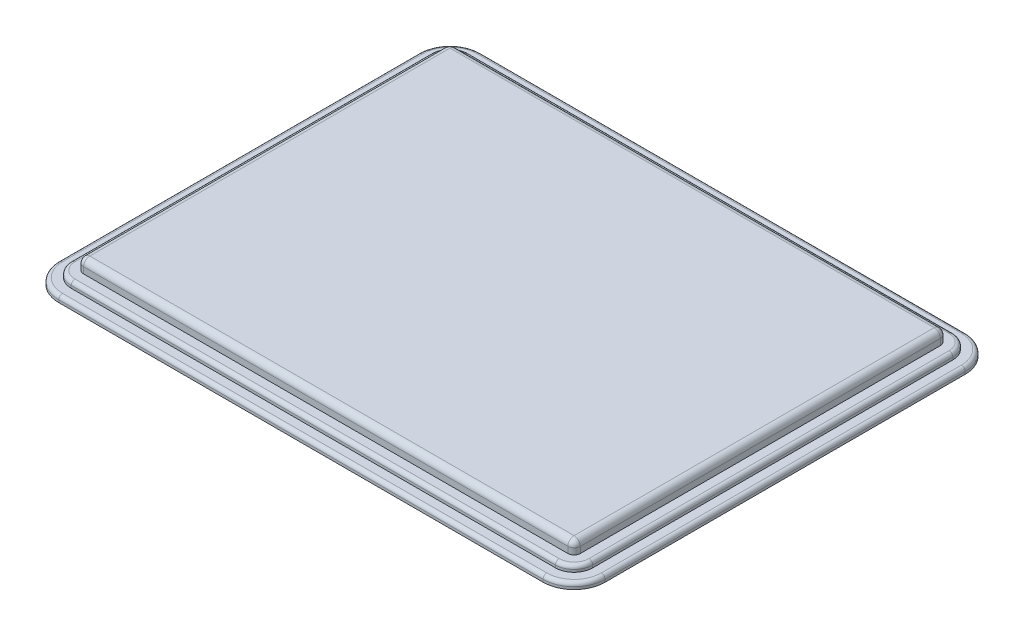
from build123d import *

# Parameters (mm, degrees)
BOSS_EXTRUDE1_DEPTH = 10
FILLET1_R           = 5
BOSS_EXTRUDE2_DEPTH = 5
BOSS_EXTRUDE3_DEPTH = 5
FILLET2_R           = 3
FILLET3_R           = 3


with BuildPart() as part:
    # Sketch3 → Boss-Extrude1 (new body)
    with BuildSketch(Plane(origin=(0, 0, 0), x_dir=(1, 0, 0), z_dir=(0, 1, 0))):
        with BuildLine():
            Line((195, -150), (-195, -150))
            ThreePointArc((-195, -150), (-198.535533906, -148.535533906), (-200, -145))
            Line((-200, -145), (-200, 145))
            ThreePointArc((-200, 145), (-198.535533906, 148.535533906), (-195, 150))
            Line((-195, 150), (195, 150))
            ThreePointArc((195, 150), (198.535533906, 148.535533906), (200, 145))
            Line((200, 145), (200, -145))
            ThreePointArc((200, -145), (198.535533906, -148.535533906), (195, -150))
        make_face()
    extrude(amount=BOSS_EXTRUDE1_DEPTH)

    # Fillet1
    fillet1_edges = [part.edges().sort_by_distance(p)[0] for p in [
        (198.535533906, 10, 148.535533906),
        (200, 10, 0),
        (198.535533906, 10, -148.535533906),
        (0, 10, -150),
        (-198.535533906, 10, -148.535533906),
        (-200, 10, 0),
        (-198.535533906, 10, 148.535533906),
        (0, 10, 150),
    ]]
    fillet(fillet1_edges, radius=FILLET1_R)


with BuildPart() as body_2:
    # Sketch4 → Boss-Extrude2 (new body)
    # profile 1 of 3: a face of its own
    with BuildSketch(Plane.XZ):
        with BuildLine():
            Line((195, 160), (-195, 160))
            ThreePointArc((-195, 160), (-205.606601718, 155.606601718), (-210, 145))
            Line((-210, 145), (-210, -145))
            ThreePointArc((-210, -145), (-205.606601718, -155.606601718), (-195, -160))
            Line((-195, -160), (195, -160))
            ThreePointArc((195, -160), (205.606601718, -155.606601718), (210, -145))
            Line((210, -145), (210, 145))
            ThreePointArc((210, 145), (205.606601718, 155.606601718), (195, 160))
        make_face()
        with BuildLine():
            ThreePointArc((-195, 150), (-198.535533906, 148.535533906), (-200, 145))
            Line((-200, 145), (-200, -145))
            ThreePointArc((-200, -145), (-198.535533906, -148.535533906), (-195, -150))
            Line((-195, -150), (195, -150))
            ThreePointArc((195, -150), (198.535533906, -148.535533906), (200, -145))
            Line((200, -145), (200, 145))
            ThreePointArc((200, 145), (198.535533906, 148.535533906), (195, 150))
            Line((195, 150), (-195, 150))
        make_face(mode=Mode.SUBTRACT)
    # profile 2 of 3: a face of its own
    with BuildSketch(Plane.XZ):
        with BuildLine():
            Line((195, 150), (-195, 150))
            ThreePointArc((-195, 150), (-198.535533906, 148.535533906), (-200, 145))
            Line((-200, 145), (-200, -145))
            ThreePointArc((-200, -145), (-198.535533906, -148.535533906), (-195, -150))
            Line((-195, -150), (195, -150))
            ThreePointArc((195, -150), (198.535533906, -148.535533906), (200, -145))
            Line((200, -145), (200, 145))
            ThreePointArc((200, 145), (198.535533906, 148.535533906), (195, 150))
        make_face()
    # profile 3 of 3: a face of its own
    with BuildSketch(Plane.XZ):
        with BuildLine():
            ThreePointArc((-195, 150), (-198.535533906, 148.535533906), (-200, 145))
            Line((-200, 145), (-200, -145))
            ThreePointArc((-200, -145), (-198.535533906, -148.535533906), (-195, -150))
            Line((-195, -150), (195, -150))
            ThreePointArc((195, -150), (198.535533906, -148.535533906), (200, -145))
            Line((200, -145), (200, 145))
            ThreePointArc((200, 145), (198.535533906, 148.535533906), (195, 150))
            Line((195, 150), (-195, 150))
        make_face()
    extrude(amount=BOSS_EXTRUDE2_DEPTH)

    # Fillet2
    fillet2_edges = [body_2.edges().sort_by_distance(p)[0] for p in [
        (210, 0, 0),
        (205.606601718, 0, -155.606601718),
        (0, 0, -160),
        (-205.606601718, 0, -155.606601718),
        (-210, 0, 0),
        (-205.606601718, 0, 155.606601718),
        (0, 0, 160),
        (205.606601718, 0, 155.606601718),
    ]]
    fillet(fillet2_edges, radius=FILLET2_R)


with BuildPart() as body_3:
    # Sketch5 → Boss-Extrude3 (new body)
    # profile 1 of 3: a face of its own
    with BuildSketch(Plane.XZ.offset(5)):
        with BuildLine():
            Line((195, 170), (-195, 170))
            ThreePointArc((-195, 170), (-212.67766953, 162.67766953), (-220, 145))
            Line((-220, 145), (-220, -145))
            ThreePointArc((-220, -145), (-212.67766953, -162.67766953), (-195, -170))
            Line((-195, -170), (195, -170))
            ThreePointArc((195, -170), (212.67766953, -162.67766953), (220, -145))
            Line((220, -145), (220, 145))
            ThreePointArc((220, 145), (212.67766953, 162.67766953), (195, 170))
        make_face()
        with BuildLine():
            Line((195, 160), (-195, 160))
            ThreePointArc((-195, 160), (-205.606601718, 155.606601718), (-210, 145))
            Line((-210, 145), (-210, -145))
            ThreePointArc((-210, -145), (-205.606601718, -155.606601718), (-195, -160))
            Line((-195, -160), (195, -160))
            ThreePointArc((195, -160), (205.606601718, -155.606601718), (210, -145))
            Line((210, -145), (210, 145))
            ThreePointArc((210, 145), (205.606601718, 155.606601718), (195, 160))
        make_face(mode=Mode.SUBTRACT)
    # profile 2 of 3: a face of its own
    with BuildSketch(Plane.XZ.offset(5)):
        with BuildLine():
            ThreePointArc((210, 145), (205.606601718, 155.606601718), (195, 160))
            Line((195, 160), (-195, 160))
            ThreePointArc((-195, 160), (-205.606601718, 155.606601718), (-210, 145))
            Line((-210, 145), (-210, -145))
            ThreePointArc((-210, -145), (-205.606601718, -155.606601718), (-195, -160))
            Line((-195, -160), (195, -160))
            ThreePointArc((195, -160), (205.606601718, -155.606601718), (210, -145))
            Line((210, -145), (210, 145))
        make_face()
    # profile 3 of 3: a face of its own
    with BuildSketch(Plane.XZ.offset(5)):
        with BuildLine():
            Line((195, 160), (-195, 160))
            ThreePointArc((-195, 160), (-205.606601718, 155.606601718), (-210, 145))
            Line((-210, 145), (-210, -145))
            ThreePointArc((-210, -145), (-205.606601718, -155.606601718), (-195, -160))
            Line((-195, -160), (195, -160))
            ThreePointArc((195, -160), (205.606601718, -155.606601718), (210, -145))
            Line((210, -145), (210, 145))
            ThreePointArc((210, 145), (205.606601718, 155.606601718), (195, 160))
        make_face()
    extrude(amount=BOSS_EXTRUDE3_DEPTH)

    # Fillet3
    fillet3_edges = [body_3.edges().sort_by_distance(p)[0] for p in [
        (220, -5, 0),
        (212.67766953, -5, -162.67766953),
        (0, -5, -170),
        (-212.67766953, -5, -162.67766953),
        (-220, -5, 0),
        (-212.67766953, -5, 162.67766953),
        (0, -5, 170),
        (212.67766953, -5, 162.67766953),
    ]]
    fillet(fillet3_edges, radius=FILLET3_R)


solid = Compound([part.part, body_2.part, body_3.part])
